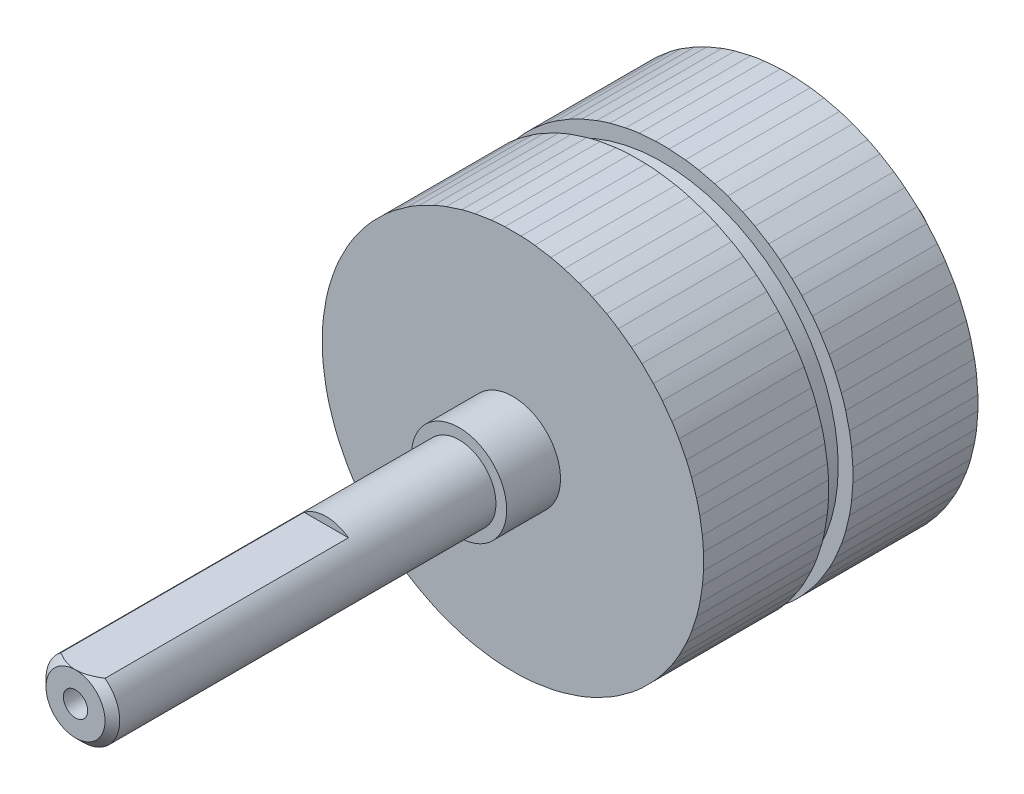
from build123d import *

# Parameters (mm, degrees)
SKETCH2_OUTSIDE_W  = 41.226
SKETCH2_OUTSIDE_H  = 41.226
CUT_EXTRUDE1_DEPTH = 8.475
SKETCH3_OUTSIDE_W  = 41.226
SKETCH3_OUTSIDE_H  = 41.226
CUT_EXTRUDE2_DEPTH = 8.475
SKETCH4_W          = 5
SKETCH4_H          = 1
CUT_EXTRUDE3_DEPTH = 17


with BuildPart() as part:
    # Sketch1 → Revolve1 (revolve)
    with BuildSketch(Plane(origin=(0, 0, 0), x_dir=(0, 0, -1), z_dir=(1, 0, 0)), mode=Mode.PRIVATE) as revolve1_sk:
        Polygon((-26.5, 0), (-26.5, -0.825), (-28, -0.825), (-28, -2), (-27.5, -2.5), (-2, -2.5), (-2, -3.225), (1.65, -3.225), (1.65, -12.925), (2.65, -11.925), (9.125, -11.925), (10.125, -12.925), (10.125, -11.925), (11.775, -11.925), (11.775, -12.925), (12.775, -11.925), (19.25, -11.925), (20.25, -12.925), (20.25, -3.225), (23, -3.225), (23, -2.5), (27.5, -2.5), (28, -2), (28, -0.875), (26.5, -0.875), (26.5, 0), align=None)
    revolve(revolve1_sk.sketch.rotate(Axis((0, 0, 34.738268814), (0, 0, -1)), 270), axis=Axis((0, 0, 34.738268814), (0, 0, -1)))

    # Sketch1<3> → Revolve2 (revolve)
    with BuildSketch(Plane(origin=(0, 0, 0), x_dir=(0, 0, -1), z_dir=(1, 0, 0)), mode=Mode.PRIVATE) as revolve2_sk:
        Polygon((1.65, -12.925), (2.65, -11.925), (9.125, -11.925), (10.125, -12.925), align=None)
        Polygon((11.775, -12.925), (12.775, -11.925), (19.25, -11.925), (20.25, -12.925), align=None)
    revolve(revolve2_sk.sketch.rotate(Axis((0, 0, 34.738268814), (0, 0, -1)), 270), axis=Axis((0, 0, 34.738268814), (0, 0, -1)))

    # Sketch2 outside → Cut-Extrude1 (cut)
    with BuildSketch(Plane.XY.offset(-1.65)):
        Rectangle(SKETCH2_OUTSIDE_W, SKETCH2_OUTSIDE_H)
        Polygon((4.956983851, 11.967217641), (3.023869864, 12.59532445), (1.016298166, 12.91329257), (-1.016298166, 12.91329257), (-3.023869864, 12.59532445), (-4.956983851, 11.967217641), (-6.768040444, 11.044438216), (-8.412445419, 9.849708069), (-9.849708069, 8.412445419), (-11.044438216, 6.768040444), (-11.967217641, 4.956983851), (-12.59532445, 3.023869864), (-12.91329257, 1.016298166), (-12.91329257, -1.016298166), (-12.59532445, -3.023869864), (-11.967217641, -4.956983851), (-11.044438216, -6.768040444), (-9.849708069, -8.412445419), (-8.412445419, -9.849708069), (-6.768040444, -11.044438216), (-4.956983851, -11.967217641), (-3.023869864, -12.59532445), (-1.016298166, -12.91329257), (1.016298166, -12.91329257), (3.023869864, -12.59532445), (4.956983851, -11.967217641), (6.768040444, -11.044438216), (8.412445419, -9.849708069), (9.849708069, -8.412445419), (11.044438216, -6.768040444), (11.967217641, -4.956983851), (12.59532445, -3.023869864), (12.91329257, -1.016298166), (12.91329257, 1.016298166), (12.59532445, 3.023869864), (11.967217641, 4.956983851), (11.044438216, 6.768040444), (9.849708069, 8.412445419), (8.412445419, 9.849708069), (6.768040444, 11.044438216), align=None, mode=Mode.SUBTRACT)
    extrude(amount=-CUT_EXTRUDE1_DEPTH, mode=Mode.SUBTRACT)

    # Sketch3 outside → Cut-Extrude2 (cut)
    with BuildSketch(Plane(origin=(0, 0, -20.25), x_dir=(-1, 0, 0), z_dir=(0, 0, -1))):
        Rectangle(SKETCH3_OUTSIDE_W, SKETCH3_OUTSIDE_H)
        Polygon((0, 12.953223034), (-2.026330516, 12.793747364), (-4.002766049, 12.319247173), (-5.880640198, 11.541406232), (-7.613713469, 10.479377566), (-9.159311845, 9.159311845), (-10.479377566, 7.613713469), (-11.541406232, 5.880640198), (-12.319247173, 4.002766049), (-12.793747364, 2.026330516), (-12.953223034, 0), (-12.793747364, -2.026330516), (-12.319247173, -4.002766049), (-11.541406232, -5.880640198), (-10.479377566, -7.613713469), (-9.159311845, -9.159311845), (-7.613713469, -10.479377566), (-5.880640198, -11.541406232), (-4.002766049, -12.319247173), (-2.026330516, -12.793747364), (0, -12.953223034), (2.026330516, -12.793747364), (4.002766049, -12.319247173), (5.880640198, -11.541406232), (7.613713469, -10.479377566), (9.159311845, -9.159311845), (10.479377566, -7.613713469), (11.541406232, -5.880640198), (12.319247173, -4.002766049), (12.793747364, -2.026330516), (12.953223034, 0), (12.793747364, 2.026330516), (12.319247173, 4.002766049), (11.541406232, 5.880640198), (10.479377566, 7.613713469), (9.159311845, 9.159311845), (7.613713469, 10.479377566), (5.880640198, 11.541406232), (4.002766049, 12.319247173), (2.026330516, 12.793747364), align=None, mode=Mode.SUBTRACT)
    extrude(amount=-CUT_EXTRUDE2_DEPTH, mode=Mode.SUBTRACT)

    # Sketch4 → Cut-Extrude3 (cut)
    with BuildSketch(Plane.XY.offset(28)):
        with Locations((0, 2.5)):
            Rectangle(SKETCH4_W, SKETCH4_H)
    extrude(amount=-CUT_EXTRUDE3_DEPTH, mode=Mode.SUBTRACT)


solid = part.part
